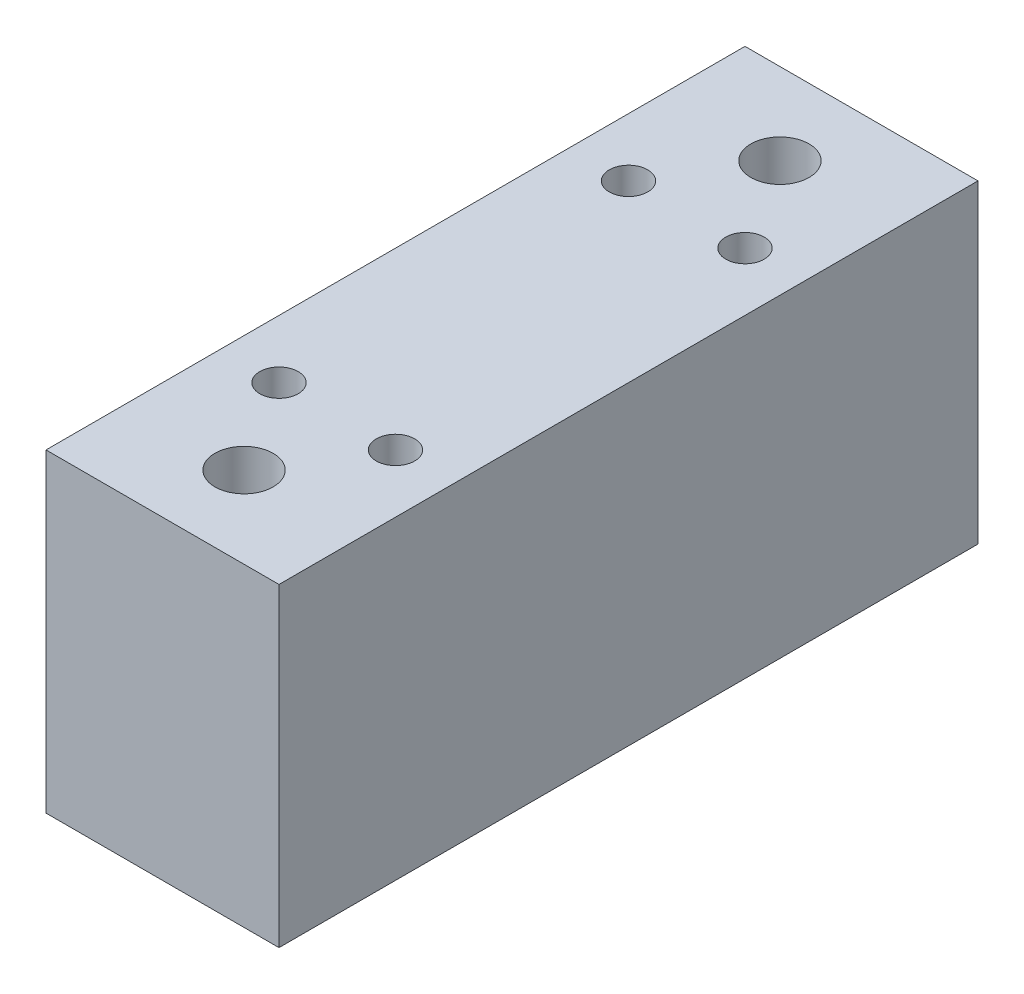
from build123d import *

# Parameters (mm, degrees)
SKETCH_1_W             = 40
SKETCH_1_H             = 27
EXTRUDE_1_DEPTH        = 60
SKETCH_2_R             = 2.5
CUT_EXTRUDE_1_DEPTH    = 27
PATTERN_LINEAR_1_COUNT = 2
PATTERN_LINEAR_1_PITCH = 46
SKETCH_4_R             = 1.65
CUT_EXTRUDE_3_DEPTH    = 27
SKETCH_5_W             = 20
SKETCH_5_H             = 60
CUT_EXTRUDE_4_DEPTH    = 30
PATTERN_LINEAR_2_COUNT = 2
PATTERN_LINEAR_2_PITCH = 10


with BuildPart() as part:
    # Эскиз1 → Бобышка-Вытянуть1 (new body)
    with BuildSketch(Plane.XY):
        Rectangle(SKETCH_1_W, SKETCH_1_H)
    extrude(amount=EXTRUDE_1_DEPTH)

    # Эскиз2 → Вырез-Вытянуть1 (cut)
    with BuildSketch(Plane(origin=(0, 13.5, 0), x_dir=(1, 0, 0), z_dir=(0, 1, 0))):
        with Locations(Location((-10, -7, 0), (0, 0, 180))):
            Circle(SKETCH_2_R)
    cut_extrude_1 = extrude(amount=-CUT_EXTRUDE_1_DEPTH, mode=Mode.SUBTRACT)

    # Линейный массив1: Вырез-Вытянуть1 ×2
    with Locations(*[(0, 0, i * PATTERN_LINEAR_1_PITCH) for i in range(1, PATTERN_LINEAR_1_COUNT)]):
        add(cut_extrude_1, mode=Mode.SUBTRACT)

    # Эскиз4 → Вырез-Вытянуть3 (cut)
    with BuildSketch(Plane(origin=(0, 13.5, 0), x_dir=(1, 0, 0), z_dir=(0, 1, 0))):
        with Locations(Location((-15, -15, 0), (0, 0, 270))):
            Circle(SKETCH_4_R)
        with Locations(Location((-15, -45, 0), (0, 0, 270))):
            Circle(SKETCH_4_R)
    cut_extrude_3 = extrude(amount=-CUT_EXTRUDE_3_DEPTH, mode=Mode.SUBTRACT)

    # Эскиз5 → Вырез-Вытянуть4 (cut)
    with BuildSketch(Plane.XZ.offset(13.5)):
        with Locations((10, 30)):
            Rectangle(SKETCH_5_W, SKETCH_5_H)
    extrude(amount=-CUT_EXTRUDE_4_DEPTH, mode=Mode.SUBTRACT)

    # Линейный массив2: Вырез-Вытянуть3 ×2
    with Locations(*[(i * PATTERN_LINEAR_2_PITCH, 0, 0) for i in range(1, PATTERN_LINEAR_2_COUNT)]):
        add(cut_extrude_3, mode=Mode.SUBTRACT)


solid = part.part
